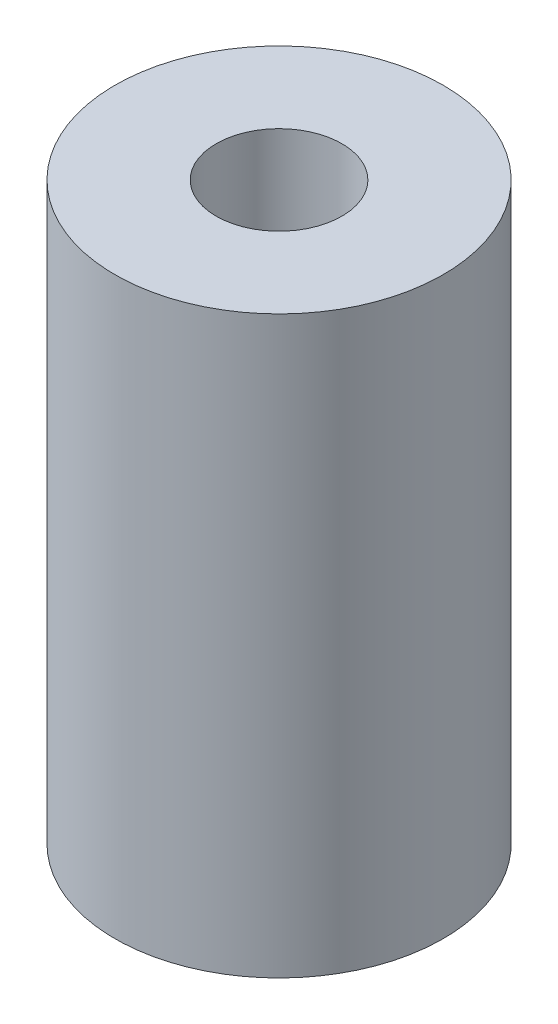
from build123d import *

# Parameters (mm, degrees)
SKETCH1_R           = 23.5
BOSS_EXTRUDE1_DEPTH = 82.35
SKETCH2_R           = 9
CUT_EXTRUDE1_DEPTH  = 100


with BuildPart() as part:
    # Sketch1 → Boss-Extrude1 (new body)
    with BuildSketch(Plane(origin=(0, 0, 0), x_dir=(1, 0, 0), z_dir=(0, 1, 0))):
        with Locations(Location((0, 0, 0), (0, 0, 90))):
            Circle(SKETCH1_R)
    extrude(amount=BOSS_EXTRUDE1_DEPTH)

    # Sketch2 → Cut-Extrude1 (cut)
    with BuildSketch(Plane(origin=(0, 82.35, 0), x_dir=(1, 0, 0), z_dir=(0, 1, 0))):
        with Locations(Location((0, 0, 0), (0, 0, 270))):
            Circle(SKETCH2_R)
    extrude(amount=-CUT_EXTRUDE1_DEPTH, mode=Mode.SUBTRACT)


solid = part.part
